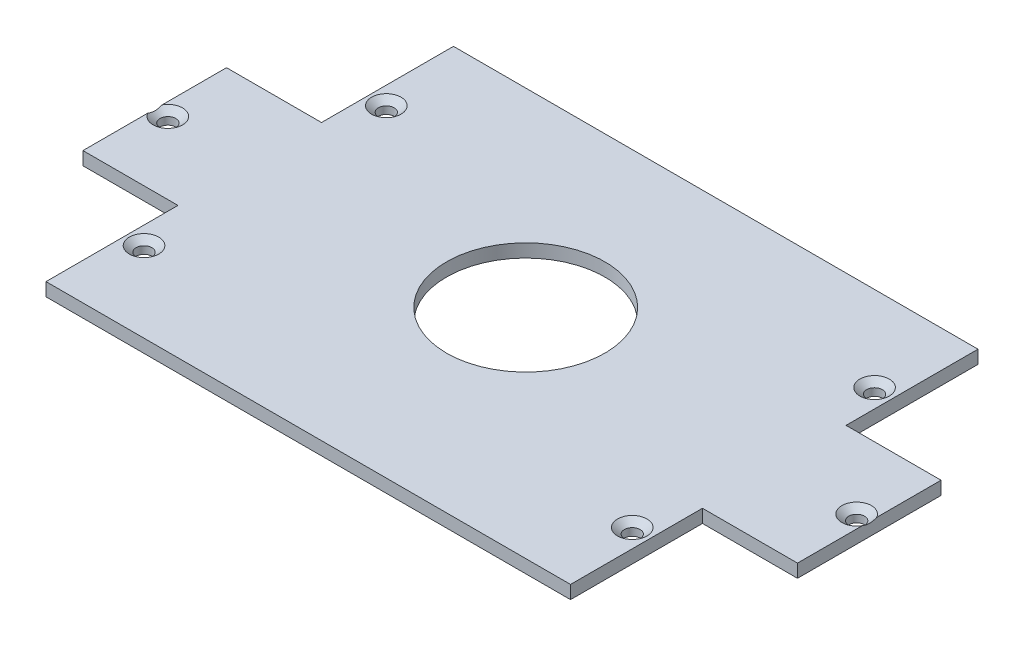
from build123d import *

# Parameters (mm, degrees)
SKETCH1_R                                         = 19.05
BOSS_EXTRUDE1_DEPTH                               = 3.175
CSK_FOR_6_FLAT_HEAD_MACHINE_SCREW_100_D           = 3.7973
CSK_FOR_6_FLAT_HEAD_MACHINE_SCREW_100_CSINK_D     = 7.0866
CSK_FOR_6_FLAT_HEAD_MACHINE_SCREW_100_CSINK_ANGLE = 100
CSK_FOR_6_FLAT_HEAD_MACHINE_SCREW_2_D             = 3.7973
CSK_FOR_6_FLAT_HEAD_MACHINE_SCREW_2_CSINK_D       = 7.0866
CSK_FOR_6_FLAT_HEAD_MACHINE_SCREW_2_CSINK_ANGLE   = 100


with BuildPart() as part:
    # Sketch1 → Boss-Extrude1 (new body)
    with BuildSketch(Plane(origin=(0, 0, 0), x_dir=(1, 0, 0), z_dir=(0, 1, 0))):
        Polygon((-63.899577335, 57.690677645), (62.306672665, 57.690677645), (62.306672665, 25.940677645), (85.166672665, 25.940677645), (85.166672665, -8.603322355), (62.306672665, -8.603322355), (62.306672665, -40.353322355), (-63.899577335, -40.353322355), (-63.899577335, -8.603322355), (-86.759577335, -8.603322355), (-86.759577335, 25.940677645), (-63.899577335, 25.940677645), align=None)
        with Locations(Location((-0.796452335, 11.970677645, 0), (0, 0, 270))):
            Circle(SKETCH1_R, mode=Mode.SUBTRACT)
    extrude(amount=BOSS_EXTRUDE1_DEPTH)

    # CSK for _6 Flat Head Machine Screw _100 (through all)
    with Locations(Plane(origin=(0, 3.175, 0), x_dir=(1, 0, 0), z_dir=(0, 1, 0))):
        with Locations((-59.613327335, 37.246553163), (-59.613327335, -21.054053163), (57.861672665, -21.054053163), (57.861672665, 37.246553163)):
            CounterSinkHole(CSK_FOR_6_FLAT_HEAD_MACHINE_SCREW_100_D / 2, CSK_FOR_6_FLAT_HEAD_MACHINE_SCREW_100_CSINK_D / 2, counter_sink_angle=CSK_FOR_6_FLAT_HEAD_MACHINE_SCREW_100_CSINK_ANGLE)

    # CSK for _6 Flat Head Machine Screw _ 2 (through all)
    with Locations(Plane(origin=(0, 3.175, 0), x_dir=(1, 0, 0), z_dir=(0, 1, 0))):
        with Locations((82.071047665, 8.73125), (-83.663952335, 8.73125)):
            CounterSinkHole(CSK_FOR_6_FLAT_HEAD_MACHINE_SCREW_2_D / 2, CSK_FOR_6_FLAT_HEAD_MACHINE_SCREW_2_CSINK_D / 2, counter_sink_angle=CSK_FOR_6_FLAT_HEAD_MACHINE_SCREW_2_CSINK_ANGLE)


solid = part.part
